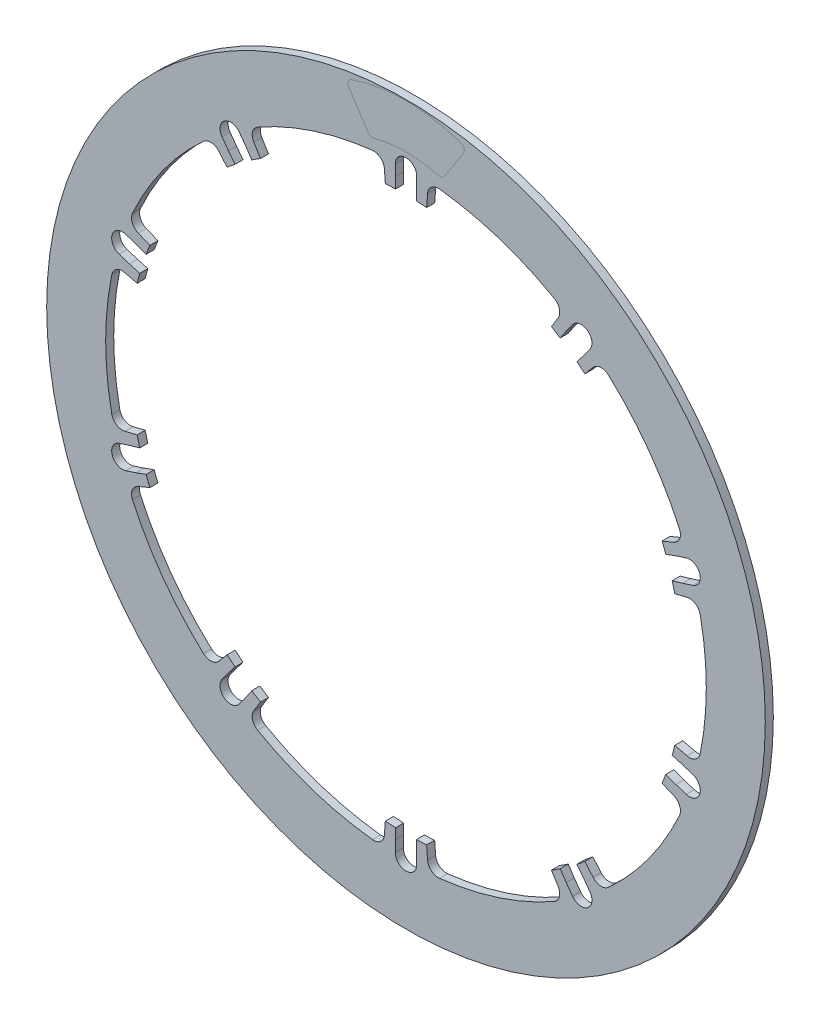
from build123d import *

# Parameters (mm, degrees)
SKETCH1_R           = 212.725
BOSS_EXTRUDE1_DEPTH = 4.7625
SKETCH8_R           = 170.18
CUT_EXTRUDE1_DEPTH  = 4.7625
CUT_EXTRUDE3_DEPTH  = 4.7625
CIRPATTERN1_COUNT   = 10
BOSS_EXTRUDE2_START = -4.7625
BOSS_EXTRUDE2_DEPTH = 4.7625
CIRPATTERN2_COUNT   = 10
CUT_EXTRUDE4_DEPTH  = 4.7625
CIRPATTERN3_COUNT   = 10


with BuildPart() as part:
    # Sketch1 → Boss-Extrude1 (new body)
    with BuildSketch(Plane.XY):
        with Locations(Location((0, 0, 0), (0, 0, 180))):
            Circle(SKETCH1_R)
    extrude(amount=BOSS_EXTRUDE1_DEPTH)

    # Sketch8 → Cut-Extrude1 (cut)
    with BuildSketch(Plane(origin=(0, 0, 0), x_dir=(-1, 0, 0), z_dir=(0, 0, -1))):
        Circle(SKETCH8_R)
    extrude(amount=-CUT_EXTRUDE1_DEPTH, mode=Mode.SUBTRACT)

    # Sketch9 → Cut-Extrude3 (cut)
    with BuildSketch(Plane(origin=(0, 0, 0), x_dir=(-1, 0, 0), z_dir=(0, 0, -1))):
        with BuildLine():
            ThreePointArc((6.35, 176.53), (0, 182.88), (-6.35, 176.53))
            Line((-6.35, 176.53), (6.35, 176.53))
        make_face()
        with BuildLine():
            Line((6.35, 176.53), (-6.35, 176.53))
            ThreePointArc((-6.35, 176.53), (-4.490128114, 172.039871993), (-1.51e-07, 170.18))
            ThreePointArc((-1.51e-07, 170.18), (4.490128007, 172.039871886), (6.35, 176.53))
        make_face()
        with BuildLine():
            ThreePointArc((-1.51e-07, 170.18), (3.175552827, 170.150369568), (6.35, 170.061488586))
            Line((6.35, 170.061488586), (6.35, 176.53))
            ThreePointArc((6.35, 176.53), (4.490128007, 172.039871886), (-1.51e-07, 170.18))
        make_face()
        with BuildLine():
            Line((-6.35, 176.53), (-6.35, 170.061488586))
            ThreePointArc((-6.35, 170.061488586), (-3.175552978, 170.150369566), (-1.51e-07, 170.18))
            ThreePointArc((-1.51e-07, 170.18), (-4.490128114, 172.039871993), (-6.35, 176.53))
        make_face()
    cut_extrude3 = extrude(amount=-CUT_EXTRUDE3_DEPTH, mode=Mode.SUBTRACT)

    # CirPattern1: Cut-Extrude3 ×10 about axis
    cirpattern1_axis = Axis((0, 0, 0), (0, 0, 1))
    for i in range(1, CIRPATTERN1_COUNT):
        add(cut_extrude3.rotate(cirpattern1_axis, i * 360 / CIRPATTERN1_COUNT), mode=Mode.SUBTRACT)

    # Sketch11 → Boss-Extrude2 (add)
    with BuildSketch(Plane.XY.offset(4.7625).offset(BOSS_EXTRUDE2_START)):
        with BuildLine():
            Line((-12.499214211, 167.15408354), (-12.216543508, 163.373880913))
            ThreePointArc((-12.216543508, 163.373880913), (-9.166397031, 163.573366003), (-6.113059701, 163.715910653))
            Line((-6.113059701, 163.715910653), (-6.35, 170.061488586))
            ThreePointArc((-6.35, 170.061488586), (-10.808670296, 169.836406717), (-15.259902334, 169.49444764))
            ThreePointArc((-15.259902334, 169.49444764), (-13.389651606, 168.902158369), (-12.499214211, 167.15408354))
        make_face()
        with BuildLine():
            ThreePointArc((15.269836972, 169.493552912), (10.813647646, 169.836089877), (6.35, 170.061488586))
            Line((6.35, 170.061488586), (6.113059701, 163.715910653))
            ThreePointArc((6.113059701, 163.715910653), (9.171190832, 163.573097295), (12.226119403, 163.373164578))
            Line((12.226119403, 163.373164578), (12.509011677, 167.15335063))
            ThreePointArc((12.509011677, 167.15335063), (13.399551531, 168.901373265), (15.269836972, 169.493552912))
        make_face()
    boss_extrude2 = extrude(amount=BOSS_EXTRUDE2_DEPTH)

    # CirPattern2: Boss-Extrude2 ×10 about axis
    cirpattern2_axis = Axis((0, 0, 0), (0, 0, 1))
    for i in range(1, CIRPATTERN2_COUNT):
        add(boss_extrude2.rotate(cirpattern2_axis, i * 360 / CIRPATTERN2_COUNT))

    # Sketch17 → Cut-Extrude4 (cut)
    with BuildSketch(Plane.XY.offset(4.7625)):
        with BuildLine():
            Line((0, 0), (110.76991022, 130.708863471))
            ThreePointArc((110.76991022, 130.708863471), (115.209063959, 132.940513661), (119.896314229, 131.292474401))
            ThreePointArc((119.896314229, 131.292474401), (143.846284335, 104.504002235), (161.920867248, 73.44707448))
            ThreePointArc((161.920867248, 73.44707448), (162.039514595, 68.479955466), (158.545108161, 64.947892023))
            Line((158.545108161, 64.947892023), (0, 0))
        make_face()
    cut_extrude4 = extrude(amount=-CUT_EXTRUDE4_DEPTH, mode=Mode.SUBTRACT)

    # CirPattern3: Cut-Extrude4 ×10 about axis
    cirpattern3_axis = Axis((0, 0, 0), (0, 0, 1))
    for i in range(1, CIRPATTERN3_COUNT):
        add(cut_extrude4.rotate(cirpattern3_axis, i * 360 / CIRPATTERN3_COUNT), mode=Mode.SUBTRACT)


solid = part.part
